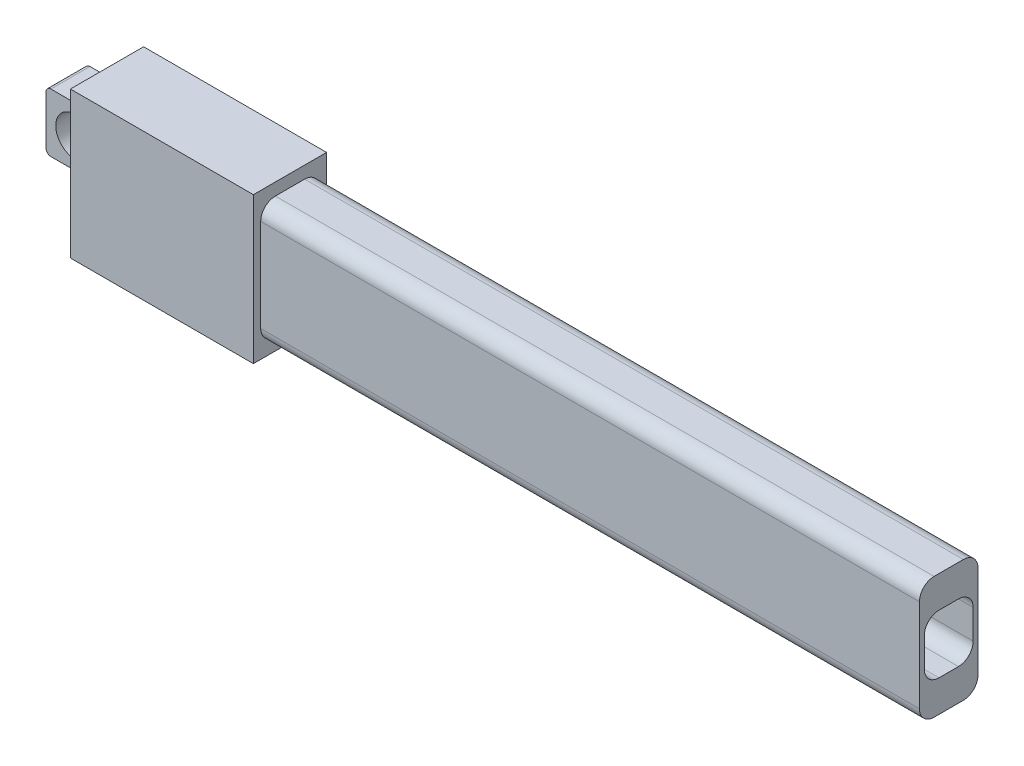
from build123d import *

# Parameters (mm, degrees)
CROQUIS1_W              = 37.5
CROQUIS1_H              = 30
SALIENTE_EXTRUIR1_DEPTH = 15
CROQUIS2_R              = 4
SALIENTE_EXTRUIR2_DEPTH = 8
SALIENTE_EXTRUIR3_DEPTH = 35
CROQUIS5_W              = 18
CROQUIS5_H              = 12
CROQUIS5_R              = 4.5
SALIENTE_EXTRUIR4_DEPTH = 5
CROQUIS6_W              = 1
CROQUIS6_H              = 12
CORTAR_EXTRUIR2_DEPTH   = 14
CROQUIS7_W              = 58.738074731
CROQUIS7_H              = 36.211204921
CORTAR_EXTRUIR4_DEPTH   = 75.820201149
CORTAR_EXTRUIR5_DEPTH   = 30
SALIENTE_EXTRUIR5_DEPTH = 100


with BuildPart() as part:
    # Croquis1 → Saliente-Extruir1 (new body)
    with BuildSketch(Plane.XY):
        Rectangle(CROQUIS1_W, CROQUIS1_H)
    extrude(amount=SALIENTE_EXTRUIR1_DEPTH)

    # Croquis2 → Saliente-Extruir2 (add)
    with BuildSketch(Plane.XY):
        with BuildLine():
            Line((-18.75, 6), (-29.75, 6))
            ThreePointArc((-29.75, 6), (-30.457106781, 5.707106781), (-30.75, 5))
            Line((-30.75, 5), (-30.75, -5))
            ThreePointArc((-30.75, -5), (-30.457106781, -5.707106781), (-29.75, -6))
            Line((-29.75, -6), (-18.75, -6))
            Line((-18.75, -6), (-18.75, 6))
        make_face()
        with Locations((-24.75, 0)):
            Circle(CROQUIS2_R, mode=Mode.SUBTRACT)
    extrude(amount=SALIENTE_EXTRUIR2_DEPTH)

    # Croquis3 → Saliente-Extruir3 (add)
    with BuildSketch(Plane(origin=(18.75, 0, 0), x_dir=(0, 0, -1), z_dir=(1, 0, 0))):
        with BuildLine():
            Line((-10.5, -12.5), (-4.5, -12.5))
            ThreePointArc((-4.5, -12.5), (-2.378679656, -11.621320344), (-1.5, -9.5))
            Line((-1.5, -9.5), (-1.5, 9.5))
            ThreePointArc((-1.5, 9.5), (-2.378679656, 11.621320344), (-4.5, 12.5))
            Line((-4.5, 12.5), (-10.5, 12.5))
            ThreePointArc((-10.5, 12.5), (-12.621320344, 11.621320344), (-13.5, 9.5))
            Line((-13.5, 9.5), (-13.5, -9.5))
            ThreePointArc((-13.5, -9.5), (-12.621320344, -11.621320344), (-10.5, -12.5))
        make_face()
    extrude(amount=SALIENTE_EXTRUIR3_DEPTH)

    # Croquis5 → Saliente-Extruir4 (add, symmetric)
    with BuildSketch(Plane.XY.offset(7.5)):
        with Locations((62.75, 0)):
            Rectangle(CROQUIS5_W, CROQUIS5_H)
        with Locations((62.75, 0)):
            Circle(CROQUIS5_R, mode=Mode.SUBTRACT)
    extrude(amount=SALIENTE_EXTRUIR4_DEPTH, both=True)

    # Croquis6 → Cortar-Extruir2 (cut)
    with BuildSketch(Plane(origin=(71.75, 0, 0), x_dir=(0, 0, -1), z_dir=(1, 0, 0))):
        with Locations((-12, 0)):
            Rectangle(CROQUIS6_W, CROQUIS6_H)
        with Locations((-3, 0)):
            Rectangle(CROQUIS6_W, CROQUIS6_H)
    extrude(amount=-CORTAR_EXTRUIR2_DEPTH, mode=Mode.SUBTRACT)

    # Croquis7 → Cortar-Extruir4 (cut, through all)
    with BuildSketch(Plane.XY.offset(15)):
        with Locations((83.119037366, -6.200481031)):
            Rectangle(CROQUIS7_W, CROQUIS7_H)
    extrude(amount=-CORTAR_EXTRUIR4_DEPTH, mode=Mode.SUBTRACT)

    # Croquis8 → Cortar-Extruir5 (cut)
    with BuildSketch(Plane(origin=(53.75, 0, 0), x_dir=(0, 0, -1), z_dir=(1, 0, 0))):
        with BuildLine():
            Line((-9.5, -6), (-5.5, -6))
            ThreePointArc((-5.5, -6), (-3.378679656, -5.121320344), (-2.5, -3))
            Line((-2.5, -3), (-2.5, 3))
            ThreePointArc((-2.5, 3), (-3.378679656, 5.121320344), (-5.5, 6))
            Line((-5.5, 6), (-9.5, 6))
            ThreePointArc((-9.5, 6), (-11.621320344, 5.121320344), (-12.5, 3))
            Line((-12.5, 3), (-12.5, -3))
            ThreePointArc((-12.5, -3), (-11.621320344, -5.121320344), (-9.5, -6))
        make_face()
    extrude(amount=-CORTAR_EXTRUIR5_DEPTH, mode=Mode.SUBTRACT)

    # Croquis10 → Saliente-Extruir5 (add)
    with BuildSketch(Plane(origin=(53.75, 0, 0), x_dir=(0, 0, -1), z_dir=(1, 0, 0))):
        with BuildLine():
            Line((-13.5, 9.5), (-13.5, -9.5))
            ThreePointArc((-13.5, -9.5), (-12.621320344, -11.621320344), (-10.5, -12.5))
            Line((-10.5, -12.5), (-4.5, -12.5))
            ThreePointArc((-4.5, -12.5), (-2.378679656, -11.621320344), (-1.5, -9.5))
            Line((-1.5, -9.5), (-1.5, 9.5))
            ThreePointArc((-1.5, 9.5), (-2.378679656, 11.621320344), (-4.5, 12.5))
            Line((-4.5, 12.5), (-10.5, 12.5))
            ThreePointArc((-10.5, 12.5), (-12.621320344, 11.621320344), (-13.5, 9.5))
        make_face()
        with BuildLine():
            Line((-2.5, -3), (-2.5, 3))
            ThreePointArc((-2.5, 3), (-3.378679656, 5.121320344), (-5.5, 6))
            Line((-5.5, 6), (-9.5, 6))
            ThreePointArc((-9.5, 6), (-11.621320344, 5.121320344), (-12.5, 3))
            Line((-12.5, 3), (-12.5, -3))
            ThreePointArc((-12.5, -3), (-11.621320344, -5.121320344), (-9.5, -6))
            Line((-9.5, -6), (-5.5, -6))
            ThreePointArc((-5.5, -6), (-3.378679656, -5.121320344), (-2.5, -3))
        make_face(mode=Mode.SUBTRACT)
    extrude(amount=SALIENTE_EXTRUIR5_DEPTH)


solid = part.part
